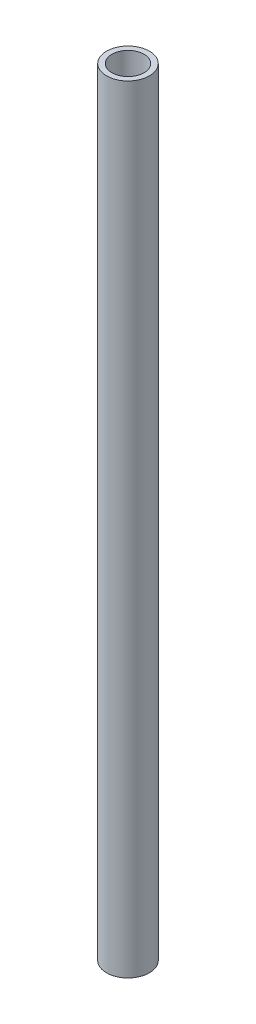
from build123d import *

# Parameters (mm, degrees)
SKETCH1_R           = 4
SKETCH1_R_2         = 3
BOSS_EXTRUDE1_DEPTH = 145


with BuildPart() as part:
    # Sketch1 → Boss-Extrude1 (new body)
    with BuildSketch(Plane(origin=(0, 0, 0), x_dir=(1, 0, 0), z_dir=(0, 1, 0))):
        with Locations(Location((0, 0, 0), (0, 0, 270))):
            Circle(SKETCH1_R)
        with Locations(Location((0, 0, 0), (0, 0, 270))):
            Circle(SKETCH1_R_2, mode=Mode.SUBTRACT)
    extrude(amount=BOSS_EXTRUDE1_DEPTH)


solid = part.part
